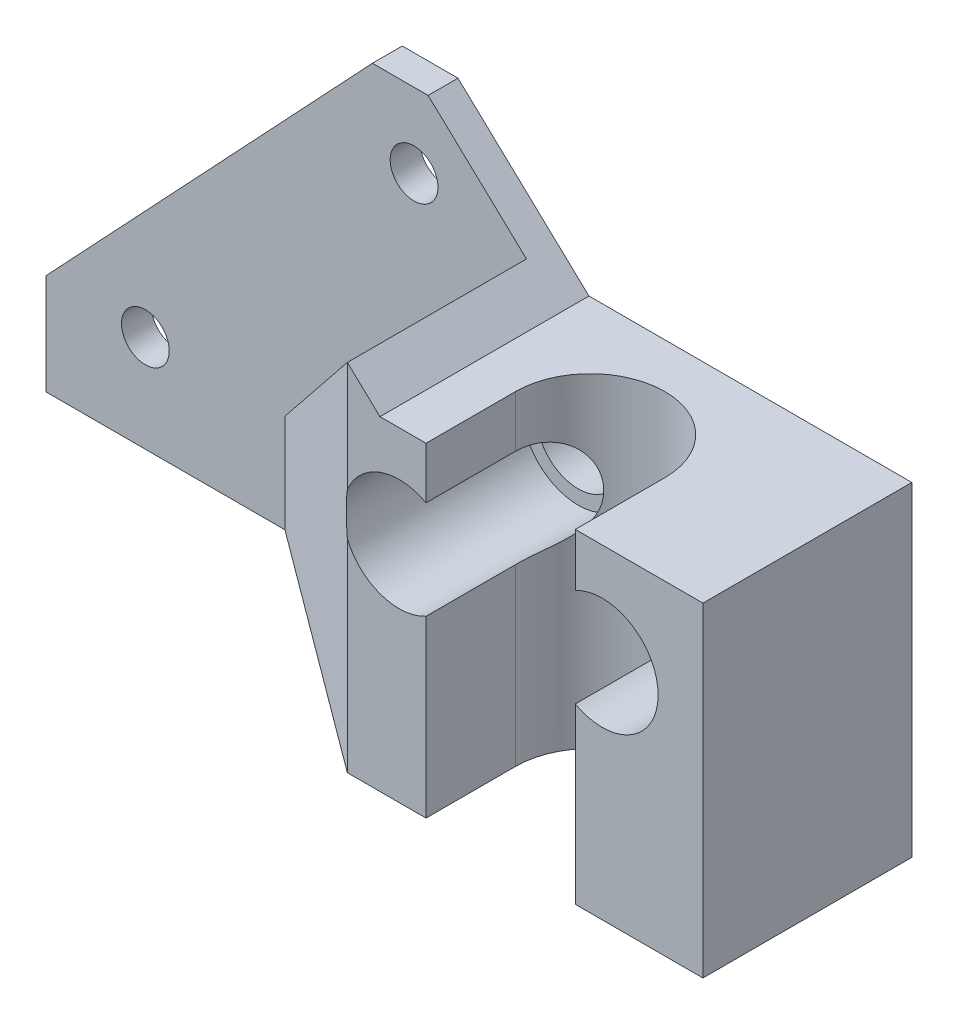
from build123d import *

# Parameters (mm, degrees)
BOSS_EXTRUDE1_DEPTH     = 2
SKETCH3_R               = 1.6
SKETCH3_R_2             = 2.8
CUT_EXTRUDE1_DEPTH      = 2
SKETCH5_R               = 3.75
BOSS_EXTRUDE2_DEPTH     = 12
CUT_EXTRUDE2_DEPTH      = 41.633693803
CUT_EXTRUDE3_DEPTH      = 41.633693891
CUT_EXTRUDE3_DEPTH_BACK = 41.633693891


with BuildPart() as part:
    # Sketch2 → Boss-Extrude1 (new body)
    with BuildSketch(Plane.XY):
        Polygon((-24.662569153, 7.22803975), (-2.803398565, 30.477324023), (0.929669822, 30.477324023), (9.704320922, 22.227324023), (31.337430847, 22.227324023), (31.337430847, 0.477324023), (-24.662569153, 0.477324023), align=None)
    extrude(amount=BOSS_EXTRUDE1_DEPTH)

    # Sketch3 → Cut-Extrude1 (cut)
    with BuildSketch(Plane.XY.offset(2)):
        with Locations((-0.012297753, 25.477324023)):
            Circle(SKETCH3_R)
        with Locations((-18.012297753, 6.977324023)):
            Circle(SKETCH3_R)
        with Locations((10.987702247, 15.477324023)):
            Circle(SKETCH3_R_2)
        with Locations((24.587430847, 15.391405477)):
            Circle(SKETCH3_R_2)
    extrude(amount=-CUT_EXTRUDE1_DEPTH, mode=Mode.SUBTRACT)

    # Sketch5 → Boss-Extrude2 (add)
    with BuildSketch(Plane.XY.offset(2)):
        Polygon((-8.662569153, 7.072030866), (7.518665156, 24.282295767), (9.704320922, 22.227324023), (31.337430847, 22.227324023), (31.337430847, 3.477324023), (31.337430847, 0.477324023), (-8.662569153, 0.477324023), align=None)
        with Locations((10.987702247, 15.477324023)):
            Circle(SKETCH5_R, mode=Mode.SUBTRACT)
        with Locations((24.587430847, 15.391405477)):
            Circle(SKETCH5_R, mode=Mode.SUBTRACT)
    extrude(amount=BOSS_EXTRUDE2_DEPTH)

    # Sketch10 → Cut-Extrude2 (cut, through all)
    with BuildSketch(Plane(origin=(0, 22.227324023, 0), x_dir=(1, 0, 0), z_dir=(0, 1, 0))):
        with BuildLine():
            Line((12.787295144, -14), (12.787295144, -8))
            ThreePointArc((12.787295144, -8), (17.787295144, -3), (22.787295144, -8))
            Line((22.787295144, -8), (22.787295144, -14))
            ThreePointArc((22.787295144, -14), (17.787295144, -19), (12.787295144, -14))
        make_face()
    extrude(amount=-CUT_EXTRUDE2_DEPTH, mode=Mode.SUBTRACT)

    # Sketch11 → Cut-Extrude3 (cut, two sides: drawn at the far end of the back side and taken through both)
    with BuildSketch(Plane(origin=(0, 22.227324023, 0), x_dir=(1, 0, 0), z_dir=(0, 1, 0)).offset(-CUT_EXTRUDE3_DEPTH_BACK)):
        Polygon((-8.662569153, -2), (7.518665156, -14), (-8.662569153, -14), align=None)
    extrude(amount=CUT_EXTRUDE3_DEPTH + CUT_EXTRUDE3_DEPTH_BACK, mode=Mode.SUBTRACT)


solid = part.part
